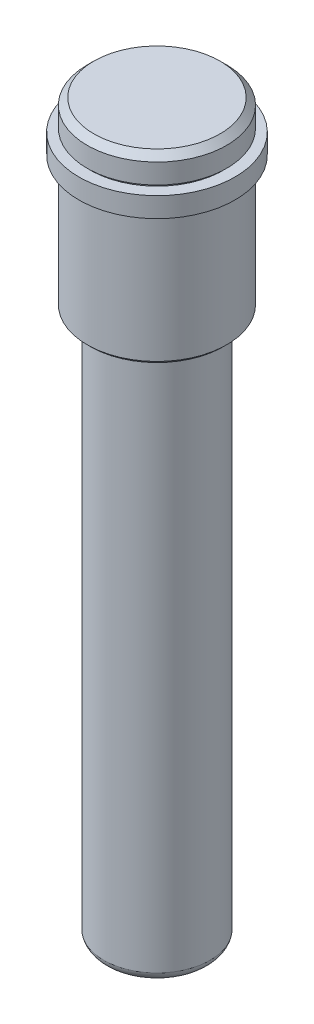
from build123d import *


with BuildPart() as part:
    # Szkic1 → Obrót2 (revolve)
    with BuildSketch(Plane.XY):
        with BuildLine():
            Line((0, 188.802213019), (-19, 188.802213019))
            Line((-19, 188.802213019), (-21, 186.802213019))
            Line((-21, 186.802213019), (-21, 180.802213019))
            Line((-21, 180.802213019), (-20, 180.802213019))
            Line((-20, 180.802213019), (-20, 179.802213019))
            Line((-20, 179.802213019), (-23.5, 179.802213019))
            Line((-23.5, 179.802213019), (-23.5, 173.802213019))
            Line((-23.5, 173.802213019), (-21, 173.802213019))
            Line((-21, 173.802213019), (-20.3, 173.802213019))
            Line((-20.3, 173.802213019), (-20.3, 173.102213019))
            Line((-20.3, 173.102213019), (-21, 173.102213019))
            Line((-21, 173.102213019), (-21, 134.802213019))
            Line((-21, 134.802213019), (-20, 133.802213019))
            Line((-20, 133.802213019), (-15, 133.802213019))
            Line((-15, 133.802213019), (-15, 132.802213019))
            Line((-15, 132.802213019), (-16, 132.802213019))
            Line((-16, 132.802213019), (-16, -28.197786981))
            ThreePointArc((-16, -28.197786981), (-15.047167049, -30.067674085), (-13.278774205, -31.197786981))
            Line((-13.278774205, -31.197786981), (0, -31.197786981))
            Line((0, -31.197786981), (0, 188.802213019))
        make_face()
    revolve(axis=Axis((0, 188.802213019, 0), (0, -1, 0)))


solid = part.part
